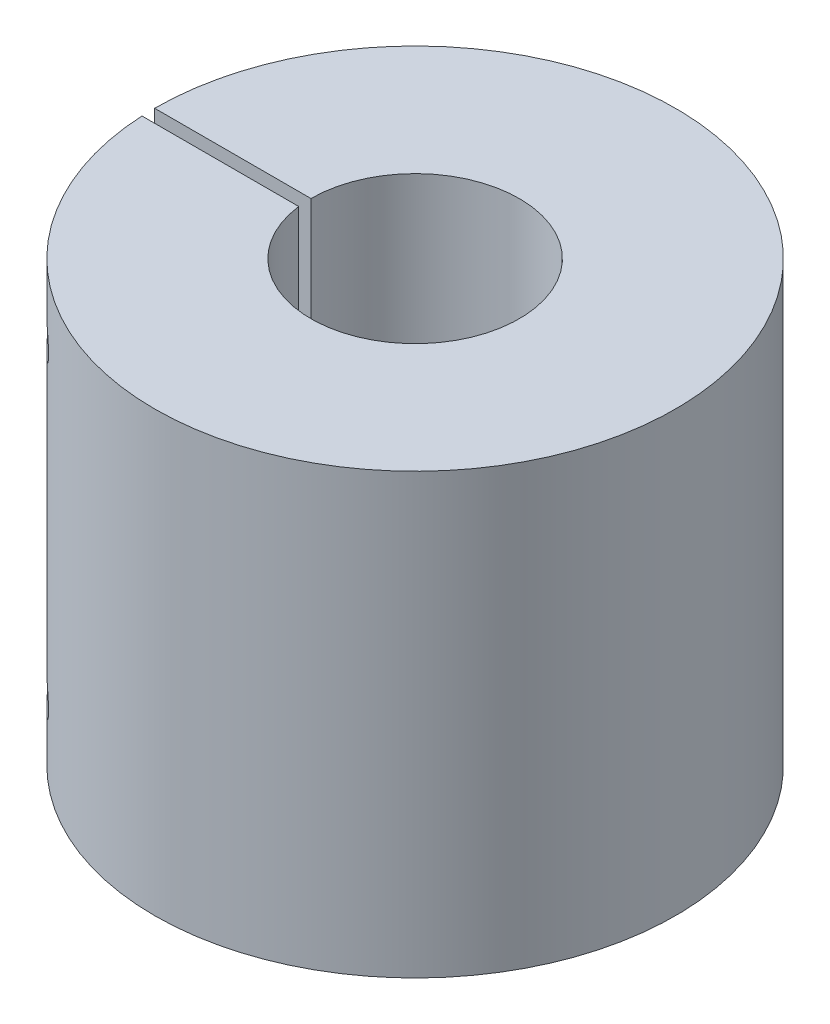
from build123d import *

# Parameters (mm, degrees)
SKETCH1_R               = 25.4
BOSS_EXTRUDE1_DEPTH     = 42.799
CUT_EXTRUDE1_DEPTH      = 56.875525957
CUT_EXTRUDE2_DEPTH      = 72.116484735
CUT_EXTRUDE2_DEPTH_BACK = 72.116484735
SKETCH3_R               = 1.651


with BuildPart() as part:
    # Sketch1 → Boss-Extrude1 (new body)
    with BuildSketch(Plane(origin=(0, 0, 0), x_dir=(1, 0, 0), z_dir=(0, 1, 0))):
        Circle(SKETCH1_R)
    extrude(amount=BOSS_EXTRUDE1_DEPTH)

    # Sketch2 → Cut-Extrude1 (cut, through all)
    with BuildSketch(Plane(origin=(0, 42.799, 0), x_dir=(1, 0, 0), z_dir=(0, 1, 0))):
        with BuildLine():
            Line((-10.16, 0), (-25.4, 0))
            ThreePointArc((-25.4, 0), (-25.392056291, -0.635198655), (-25.368230131, -1.27))
            Line((-25.368230131, -1.27), (-10.080312495, -1.27))
            ThreePointArc((-10.080312495, -1.27), (10.140058554, 0.636248791), (-10.16, 0))
        make_face()
    extrude(amount=-CUT_EXTRUDE1_DEPTH, mode=Mode.SUBTRACT)

    # Sketch3 → Cut-Extrude2 (cut, two sides: drawn at the far end of the back side and taken through both)
    with BuildSketch(Plane.XY.offset(-25.4).offset(-CUT_EXTRUDE2_DEPTH_BACK)):
        with Locations((-17.78, 36.449)):
            Circle(SKETCH3_R)
        with Locations((-17.78, 6.35)):
            Circle(SKETCH3_R)
    extrude(amount=CUT_EXTRUDE2_DEPTH + CUT_EXTRUDE2_DEPTH_BACK, mode=Mode.SUBTRACT)


solid = part.part
